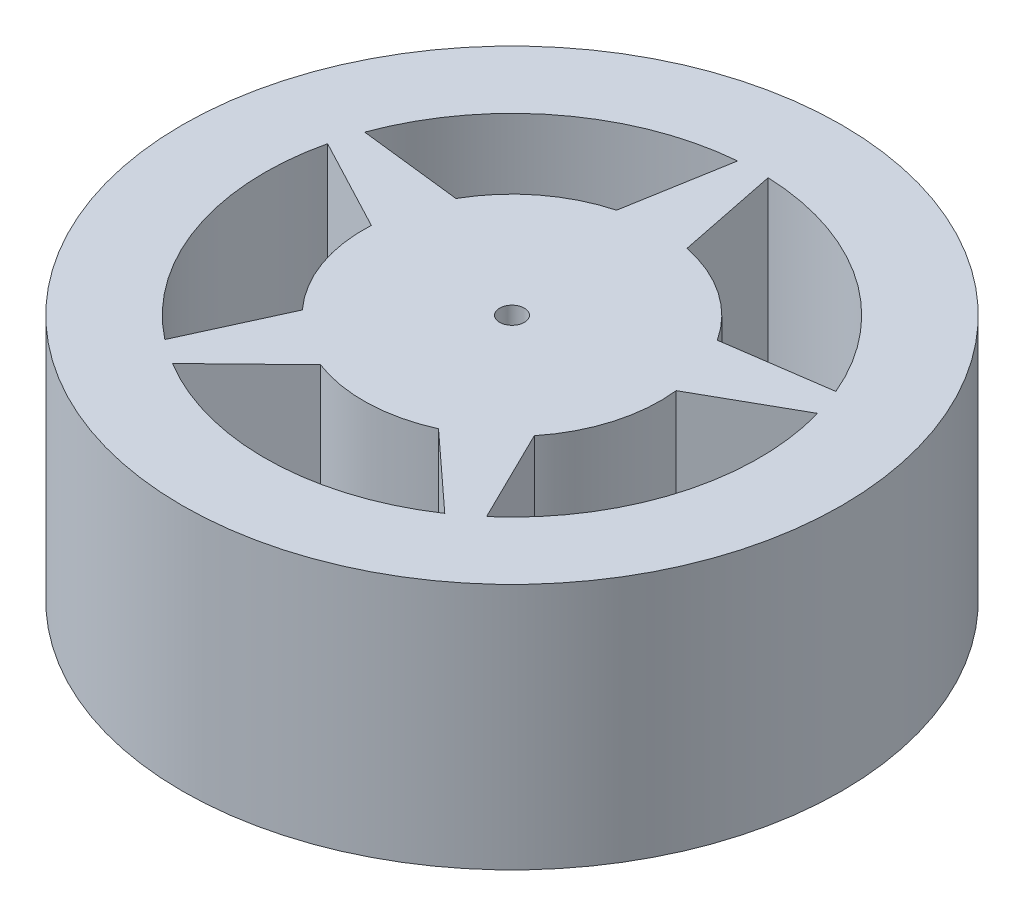
from build123d import *

# Parameters (mm, degrees)
SKETCH1_R           = 40
BOSS_EXTRUDE1_DEPTH = 30
CUT_EXTRUDE2_DEPTH  = 40
SKETCH4_R           = 1.5
CUT_EXTRUDE3_DEPTH  = 40


with BuildPart() as part:
    # Sketch1 → Boss-Extrude1 (new body)
    with BuildSketch(Plane(origin=(0, 0, 0), x_dir=(1, 0, 0), z_dir=(0, 1, 0))):
        with Locations(Location((0, 0, 0), (0, 0, 270))):
            Circle(SKETCH1_R)
    extrude(amount=BOSS_EXTRUDE1_DEPTH)

    # Sketch2 → Cut-Extrude2 (cut)
    with BuildSketch(Plane(origin=(0, 30, 0), x_dir=(1, 0, 0), z_dir=(0, 1, 0))):
        with BuildLine():
            Line((-2.524208574, 29.893617564), (-4.690828974, 17.378035664))
            ThreePointArc((-4.690828974, 17.378035664), (-11.0328045, 14.222419796), (-15.666106265, 8.864147702))
            Line((-15.666106265, 8.864147702), (-28.175793715, 10.301681829))
            ThreePointArc((-28.175793715, 10.301681829), (-18.209434961, 23.841486497), (-2.524208574, 29.893617564))
        make_face()
        with BuildLine():
            Line((1.090682544, 29.980166971), (3.589212362, 17.638524729))
            ThreePointArc((3.589212362, 17.638524729), (10.117000938, 14.887790031), (15.077948188, 9.831351812))
            Line((15.077948188, 9.831351812), (27.650496433, 11.638300864))
            ThreePointArc((27.650496433, 11.638300864), (17.04757623, 24.685626277), (1.090682544, 29.980166971))
        make_face()
        with BuildLine():
            Line((28.849872599, 8.227080347), (17.884361498, 2.037060092))
            ThreePointArc((17.884361498, 2.037060092), (17.285454944, -5.021259539), (14.009513435, -11.301926089))
            Line((14.009513435, -11.301926089), (19.613155176, -22.700752059))
            ThreePointArc((19.613155176, -22.700752059), (28.745416497, -8.584930424), (28.849872599, 8.227080347))
        make_face()
        with BuildLine():
            Line((16.739519293, -24.895551688), (7.463930911, -16.379552355))
            ThreePointArc((7.463930911, -16.379552355), (0.565997728, -17.991099093), (-6.419592719, -16.816326273))
            Line((-6.419592719, -16.816326273), (-15.528899908, -25.668137207))
            ThreePointArc((-15.528899908, -25.668137207), (0.718068186, -29.99140507), (16.739519293, -24.895551688))
        make_face()
        with BuildLine():
            Line((-18.50428072, -23.613377459), (-13.271398505, -12.160180168))
            ThreePointArc((-13.271398505, -12.160180168), (-16.935649111, -6.097851195), (-17.977039929, 0.908864886))
            Line((-17.977039929, 0.908864886), (-29.210543127, 6.836970837))
            ThreePointArc((-29.210543127, 6.836970837), (-28.301625952, -9.950777279), (-18.50428072, -23.613377459))
        make_face()
    extrude(amount=-CUT_EXTRUDE2_DEPTH, mode=Mode.SUBTRACT)

    # Sketch4 → Cut-Extrude3 (cut)
    with BuildSketch(Plane(origin=(0, 30, 0), x_dir=(1, 0, 0), z_dir=(0, 1, 0))):
        with Locations(Location((0, 0, 0), (0, 0, 270))):
            Circle(SKETCH4_R)
    extrude(amount=-CUT_EXTRUDE3_DEPTH, mode=Mode.SUBTRACT)


solid = part.part
